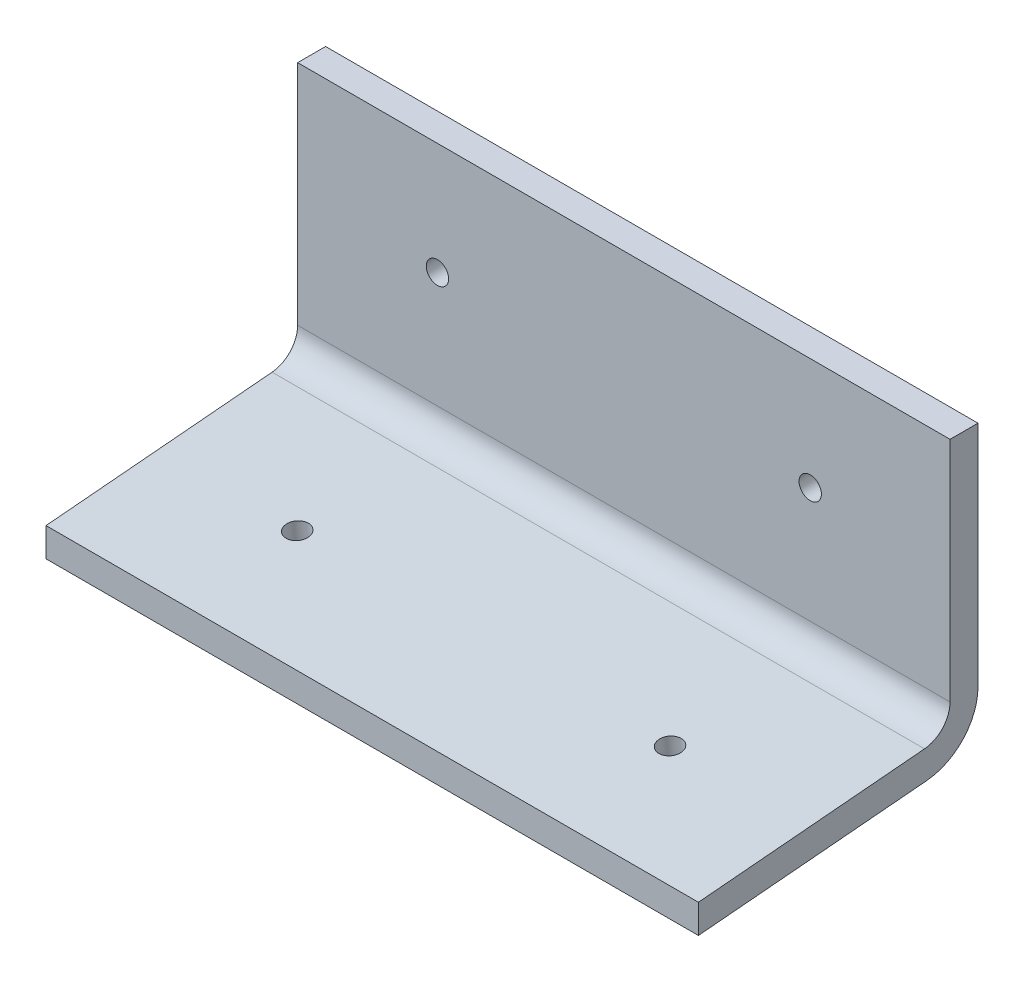
from build123d import *

# Parameters (mm, degrees)
BOSS_EXTRUDE1_DEPTH = 88.9
SKETCH13_R          = 1.524
CUT_EXTRUDE1_DEPTH  = 88.9
SKETCH12_R          = 1.524
CUT_EXTRUDE2_DEPTH  = 88.9


with BuildPart() as part:
    # Sketch11 → Boss-Extrude1 (new body)
    with BuildSketch(Plane(origin=(0, 0, 0), x_dir=(0, 0, -1), z_dir=(1, 0, 0))):
        with BuildLine():
            Line((0, 0), (0, -31.09642636))
            ThreePointArc((0, -31.09642636), (-2.001946694, -36.244423742), (-6.95587324, -38.68742996))
            Line((-6.95587324, -38.68742996), (-38.1, -41.412187987))
            Line((-38.1, -41.412187987), (-38.1, -37.486427648))
            Line((-38.1, -37.486427648), (-7.28793662, -34.790721402))
            ThreePointArc((-7.28793662, -34.790721402), (-4.810973347, -33.569218294), (-3.81, -30.995219603))
            Line((-3.81, -30.995219603), (-3.81, 0))
            Line((-3.81, 0), (0, 0))
        make_face()
    extrude(amount=BOSS_EXTRUDE1_DEPTH)

    # Sketch13 → Cut-Extrude1 (cut)
    with BuildSketch(Plane.XY.offset(3.81)):
        with Locations((69.85, -15.24)):
            Circle(SKETCH13_R)
        with Locations((19.05, -15.24)):
            Circle(SKETCH13_R)
    extrude(amount=-CUT_EXTRUDE1_DEPTH, mode=Mode.SUBTRACT)

    # Sketch12 → Cut-Extrude2 (cut)
    with BuildSketch(Plane(origin=(0, -33.89367833, -2.965312619), x_dir=(1, 0, 0), z_dir=(0, 0.9961946980917459, 0.08715574274765452))):
        with Locations(Location((69.85, -25.982175442, 0), (0, 0, 270))):
            Circle(SKETCH12_R)
        with Locations(Location((19.05, -25.982175442, 0), (0, 0, 270))):
            Circle(SKETCH12_R)
    extrude(amount=-CUT_EXTRUDE2_DEPTH, mode=Mode.SUBTRACT)


solid = part.part
